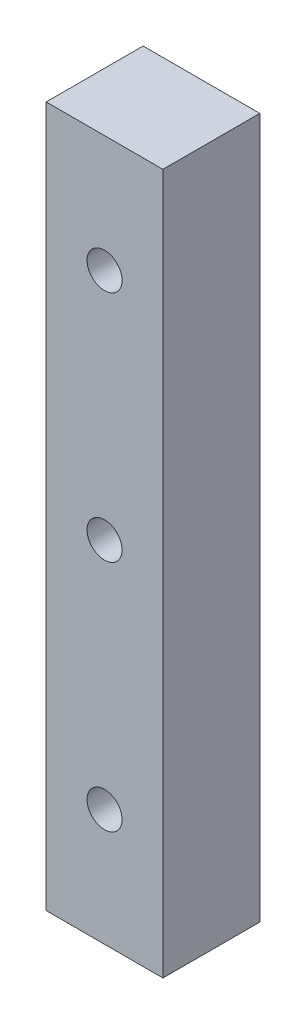
from build123d import *

# Parameters (mm, degrees)
ESQUISSE1_W             = 10
ESQUISSE1_H             = 60
EXTRUSION1_DEPTH        = 8.3
ESQUISSE2_R             = 1.5
ENL_V_MAT_EXTRU_1_DEPTH = 10


with BuildPart() as part:
    # Esquisse1 → Extrusion1 (new body)
    with BuildSketch(Plane.XY):
        Rectangle(ESQUISSE1_W, ESQUISSE1_H)
    extrude(amount=EXTRUSION1_DEPTH)

    # Esquisse2 → Enlèv. mat.-Extru.1 (cut)
    with BuildSketch(Plane.XY.offset(8.3)):
        with Locations((0, -20)):
            Circle(ESQUISSE2_R)
        Circle(ESQUISSE2_R)
        with Locations((0, 20)):
            Circle(ESQUISSE2_R)
    extrude(amount=-ENL_V_MAT_EXTRU_1_DEPTH, mode=Mode.SUBTRACT)


solid = part.part
